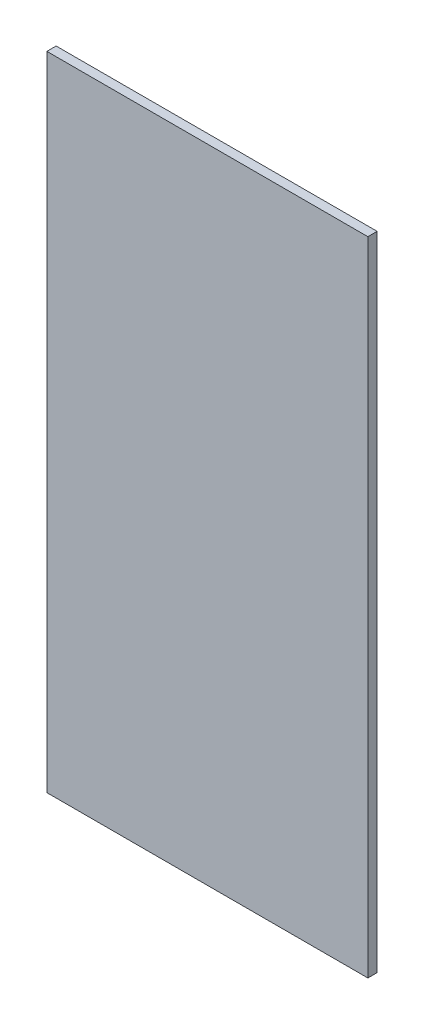
from build123d import *

# Parameters (mm, degrees)
SKETCH1_W           = 165.1
SKETCH1_H           = 330.2
BOSS_EXTRUDE1_DEPTH = 4.7625


with BuildPart() as part:
    # Sketch1 → Boss-Extrude1 (new body)
    with BuildSketch(Plane.XY):
        Rectangle(SKETCH1_W, SKETCH1_H)
    extrude(amount=BOSS_EXTRUDE1_DEPTH)


solid = part.part
